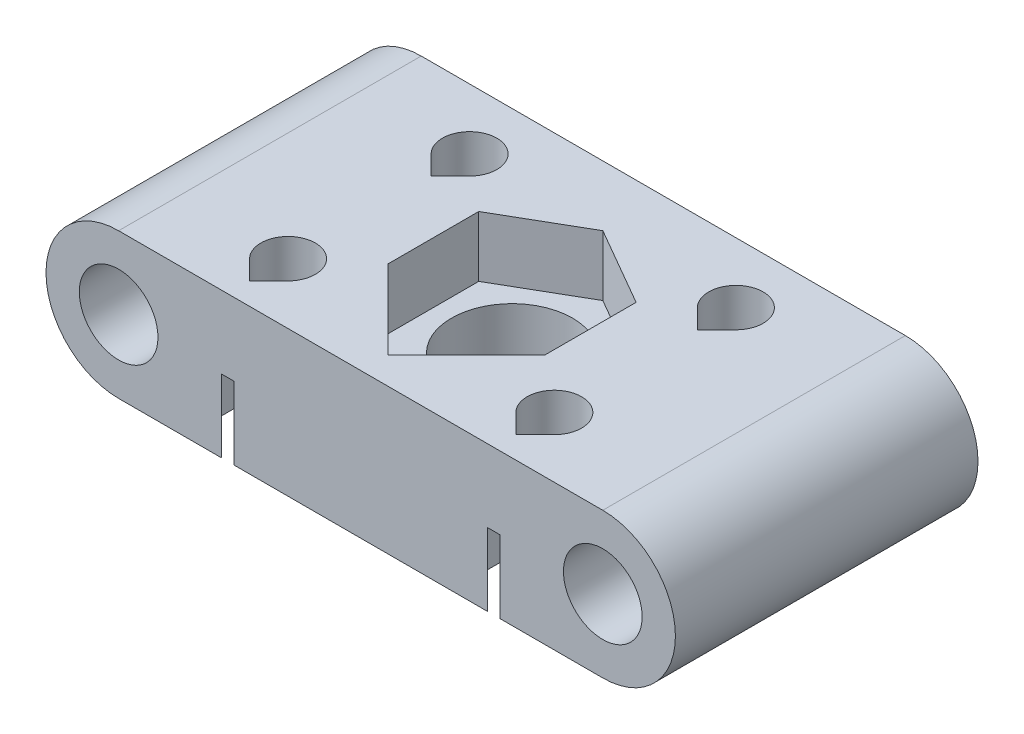
from build123d import *

# Parameters (mm, degrees)
SKETCH1_R           = 3.25
BOSS_EXTRUDE1_DEPTH = 12.5
CUT_EXTRUDE1_DEPTH  = 32.2449996
CUT_EXTRUDE2_DEPTH  = 5
CUT_EXTRUDE3_DEPTH  = 32.2449996
CUT_EXTRUDE4_DEPTH  = 2
CUT_EXTRUDE5_DEPTH  = 6


with BuildPart() as part:
    # Sketch1 → Boss-Extrude1 (new, symmetric)
    with BuildSketch(Plane.XY):
        with BuildLine():
            Line((-20, 6), (20, 6))
            ThreePointArc((20, 6), (26, 0), (20, -6))
            Line((20, -6), (-20, -6))
            ThreePointArc((-20, -6), (-26, 0), (-20, 6))
        make_face()
        with Locations((20, 0)):
            Circle(SKETCH1_R, mode=Mode.SUBTRACT)
        with Locations((-20, 0)):
            Circle(SKETCH1_R, mode=Mode.SUBTRACT)
    extrude(amount=BOSS_EXTRUDE1_DEPTH, both=True)

    # Sketch2 → Cut-Extrude1 (cut, through all)
    with BuildSketch(Plane(origin=(0, 6, 0), x_dir=(1, 0, 0), z_dir=(0, 1, 0))):
        with BuildLine():
            Line((-3.535533906, -3.535533906), (0, -7.071067812))
            Line((0, -7.071067812), (3.535533906, -3.535533906))
            ThreePointArc((3.535533906, -3.535533906), (0, 5), (-3.535533906, -3.535533906))
        make_face()
    extrude(amount=-CUT_EXTRUDE1_DEPTH, mode=Mode.SUBTRACT)

    # Sketch3 → Cut-Extrude2 (cut)
    with BuildSketch(Plane(origin=(0, 6, 0), x_dir=(1, 0, 0), z_dir=(0, 1, 0))):
        Polygon((-6.5, -3.75277675), (0, -10.25277675), (6.5, -3.75277675), (6.5, 3.75277675), (0, 7.505553499), (-6.5, 3.75277675), align=None)
    extrude(amount=-CUT_EXTRUDE2_DEPTH, mode=Mode.SUBTRACT)

    # Sketch4 → Cut-Extrude3 (cut, through all)
    with BuildSketch(Plane(origin=(0, 6, 0), x_dir=(1, 0, 0), z_dir=(0, 1, 0))):
        with BuildLine():
            Line((-9.409009742, 5.909009742), (-11, 4.318019485))
            Line((-11, 4.318019485), (-12.590990258, 5.909009742))
            ThreePointArc((-12.590990258, 5.909009742), (-11, 9.75), (-9.409009742, 5.909009742))
        make_face()
        with BuildLine():
            Line((11, 4.318019485), (12.590990258, 5.909009742))
            ThreePointArc((12.590990258, 5.909009742), (11, 9.75), (9.409009742, 5.909009742))
            Line((9.409009742, 5.909009742), (11, 4.318019485))
        make_face()
        with BuildLine():
            Line((-9.409009742, -9.090990258), (-11, -10.681980515))
            Line((-11, -10.681980515), (-12.590990258, -9.090990258))
            ThreePointArc((-12.590990258, -9.090990258), (-11, -5.25), (-9.409009742, -9.090990258))
        make_face()
        with BuildLine():
            Line((11, -10.681980515), (12.590990258, -9.090990258))
            ThreePointArc((12.590990258, -9.090990258), (11, -5.25), (9.409009742, -9.090990258))
            Line((9.409009742, -9.090990258), (11, -10.681980515))
        make_face()
    extrude(amount=-CUT_EXTRUDE3_DEPTH, mode=Mode.SUBTRACT)

    # Sketch5 → Cut-Extrude4 (cut)
    with BuildSketch(Plane.XZ.offset(6)):
        with BuildLine():
            Line((-5.656854249, 5.656854249), (0, 11.313708499))
            Line((0, 11.313708499), (5.656854249, 5.656854249))
            ThreePointArc((5.656854249, 5.656854249), (0, -8), (-5.656854249, 5.656854249))
        make_face()
    extrude(amount=-CUT_EXTRUDE4_DEPTH, mode=Mode.SUBTRACT)

    # Sketch6 → Cut-Extrude5 (cut)
    with BuildSketch(Plane.XZ.offset(6)):
        Polygon((-14.5, 9.520725942), (-11, 13.020725942), (-7.5, 9.520725942), (-7.5, 5.479274058), (-11, 3.458548116), (-14.5, 5.479274058), align=None)
        Polygon((7.5, -5.479274058), (7.5, -9.520725942), (11, -11.541451884), (14.5, -9.520725942), (14.5, -5.479274058), (11, -1.979274058), align=None)
        Polygon((7.5, 9.520725942), (7.5, 5.479274058), (11, 3.458548116), (14.5, 5.479274058), (14.5, 9.520725942), (11, 13.020725942), align=None)
        Polygon((-14.5, -5.479274058), (-14.5, -9.520725942), (-11, -11.541451884), (-7.5, -9.520725942), (-7.5, -5.479274058), (-11, -1.979274058), align=None)
    extrude(amount=-CUT_EXTRUDE5_DEPTH, mode=Mode.SUBTRACT)


solid = part.part
